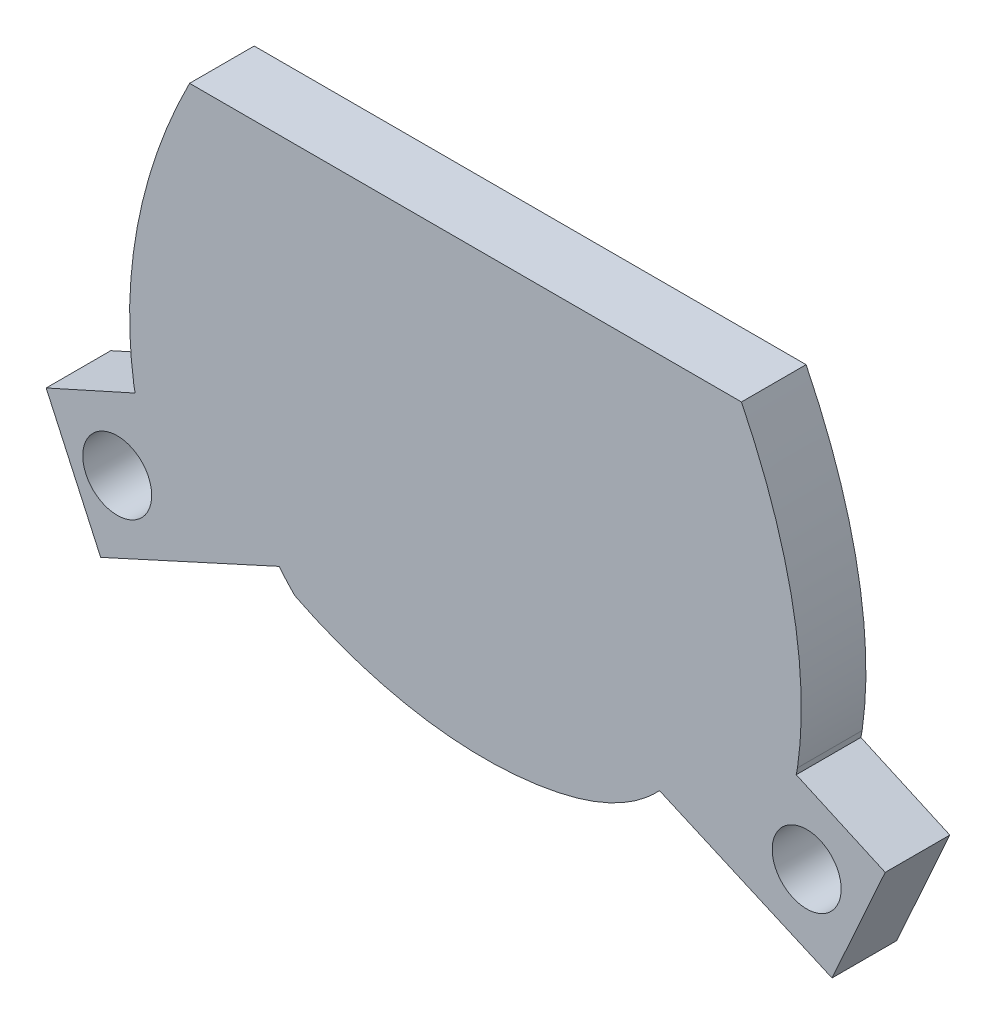
from build123d import *

# Parameters (mm, degrees)
BOSS_EXTRUDE1_START = -2
SKETCH1_R           = 0.8
BOSS_EXTRUDE1_DEPTH = 1.5


with BuildPart() as part:
    # Sketch1 → Boss-Extrude1 (new body)
    with BuildSketch(Plane.XY.offset(BOSS_EXTRUDE1_START)):
        with BuildLine():
            Line((-9.740911438, -2.722813484), (-8.476189779, -5.495368755))
            Line((-8.476189779, -5.495368755), (-4.334626233, -3.606163814))
            add(Edge.make_bspline(
                [(-4.334626233, -3.606163814), (-4.220059154, -3.746893984), (-4.098911696, -3.882323382), (-3.971959366, -4.012075441)],
                knots=[0, 0, 0, 0, 0.126750823, 0.126750823, 0.126750823, 0.126750823], degree=3))
            add(Edge.make_bspline(
                [(4.494162658, -3.699077527), (3.751409152, -4.48949841), (0.818181256, -5.496970155), (-2.253055886, -4.873398081), (-3.971959366, -4.012075441)],
                knots=[0, 0, 0, 0, 0.35390124, 1, 1, 1, 1], degree=3))
            Line((4.494162658, -3.699077527), (8.498351825, -5.462813486))
            Line((8.498351825, -5.462813486), (9.73228444, -2.722813484))
            Line((9.73228444, -2.722813484), (7.667616443, -1.793010133))
            Line((7.667616443, -1.793010133), (7.696555299, -1.640039759))
            add(Edge.make_bspline(
                [(6.39631974, 5.064495713), (6.677952564, 4.488955557), (7.263392082, 3.091949217), (7.791107632, 0.878451291), (7.813586585, -0.798840627), (7.703296692, -1.594388982), (7.696555299, -1.640039759)],
                knots=[0.013511716, 0.013511716, 0.013511716, 0.013511716, 0.127684465, 0.281511893, 0.415370359, 0.42352788, 0.42352788, 0.42352788, 0.42352788], degree=3))
            Line((6.39631974, 5.064495713), (-6.412751764, 5.064495713))
            add(Edge.make_bspline(
                [(-7.706044999, -1.640039759), (-7.92409566, -0.185434038), (-7.675413336, 2.149266822), (-6.7968854, 4.310558244), (-6.412751764, 5.064495713)],
                knots=[0, 0, 0, 0, 0.611703094, 0.967799176, 0.967799176, 0.967799176, 0.967799176], degree=3))
            Line((-7.706044999, -1.640039759), (-7.676243441, -1.793010133))
            Line((-7.676243441, -1.793010133), (-9.740911438, -2.722813484))
        make_face()
        with Locations((-8.091798032, -3.657959287)):
            Circle(SKETCH1_R, mode=Mode.SUBTRACT)
        with Locations((7.909888927, -3.569882761)):
            Circle(SKETCH1_R, mode=Mode.SUBTRACT)
    extrude(amount=-BOSS_EXTRUDE1_DEPTH)


solid = part.part
